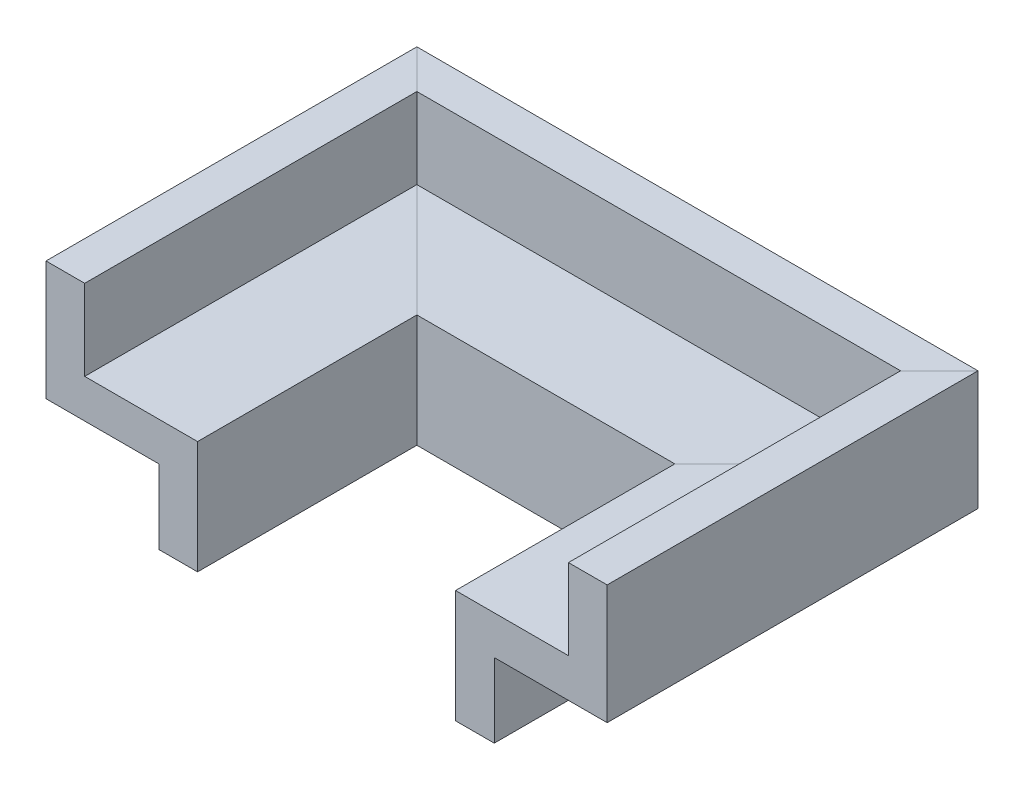
from build123d import *


with BuildPart() as part:
    # Sweep1: sweep along a path in Sketch2
    with BuildLine(Plane(origin=(0, 0, 0), x_dir=(1, 0, 0), z_dir=(0, 1, 0))) as sweep1_path:
        Line((-52, 0), (-52, 80))
        Line((-52, 80), (52, 80))
        Line((52, 80), (52, 0))
    # Sketch3 → Sweep1 (sweep)
    with BuildSketch(Plane.XY):
        Polygon((-52, 0), (-87, 0), (-87, 37), (-75, 37), (-75, 12), (-40, 12), (-40, -23), (-52, -23), align=None)
    sweep(path=sweep1_path.line, transition=Transition.RIGHT)


solid = part.part
